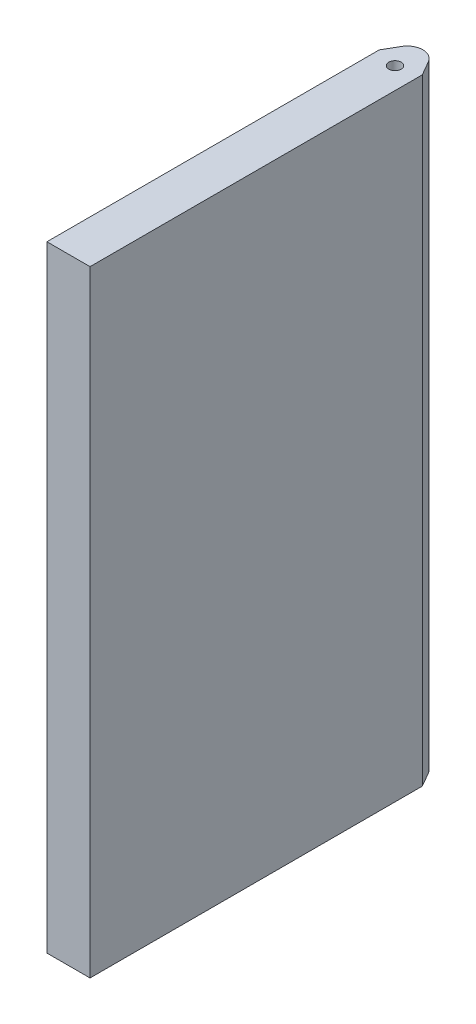
from build123d import *

# Parameters (mm, degrees)
SKETCH1_W           = 30
SKETCH1_H           = 120
BOSS_EXTRUDE1_DEPTH = 200
SKETCH2_OUTSIDE_W   = 79.032
SKETCH2_OUTSIDE_H   = 169.032
CUT_EXTRUDE2_DEPTH  = 210.344214155
FILLET1_R           = 5
CUT_EXTRUDE3_DEPTH  = 210.344214155
SKETCH4_R           = 2
CUT_EXTRUDE4_DEPTH  = 209.92343095


with BuildPart() as part:
    # Sketch1 → Boss-Extrude1 (new body)
    with BuildSketch(Plane(origin=(0, 0, 0), x_dir=(1, 0, 0), z_dir=(0, 1, 0))):
        Rectangle(SKETCH1_W, SKETCH1_H)
    extrude(amount=BOSS_EXTRUDE1_DEPTH)

    # Sketch2 outside → Cut-Extrude2 (cut, through all)
    with BuildSketch(Plane(origin=(0, 200, 0), x_dir=(1, 0, 0), z_dir=(0, 1, 0))):
        Rectangle(SKETCH2_OUTSIDE_W, SKETCH2_OUTSIDE_H)
        Polygon((0, 60), (-15, 34.019237886), (-15, -60), (15, -60), (15, 34.019237886), align=None, mode=Mode.SUBTRACT)
    extrude(amount=-CUT_EXTRUDE2_DEPTH, mode=Mode.SUBTRACT)

    # Fillet1
    fillet1_edges = [part.edges().sort_by_distance(p)[0] for p in [
        (0, 100, -60),
    ]]
    fillet(fillet1_edges, radius=FILLET1_R)

    # Sketch3 → Cut-Extrude3 (cut, through all)
    with BuildSketch(Plane(origin=(0, 200, 0), x_dir=(1, 0, 0), z_dir=(0, 1, 0))):
        Polygon((-15, 34.019237886), (-15, -60), (-7, -60), (-7, 47.875644347), align=None)
        Polygon((7, 47.875644347), (7, -60), (15, -60), (15, 34.019237886), align=None)
    extrude(amount=-CUT_EXTRUDE3_DEPTH, mode=Mode.SUBTRACT)

    # Sketch4 → Cut-Extrude4 (cut, through all)
    with BuildSketch(Plane.XZ):
        with Locations(Location((0, -46, 0), (0, 0, 270))):
            Circle(SKETCH4_R)
    extrude(amount=-CUT_EXTRUDE4_DEPTH, mode=Mode.SUBTRACT)


solid = part.part
